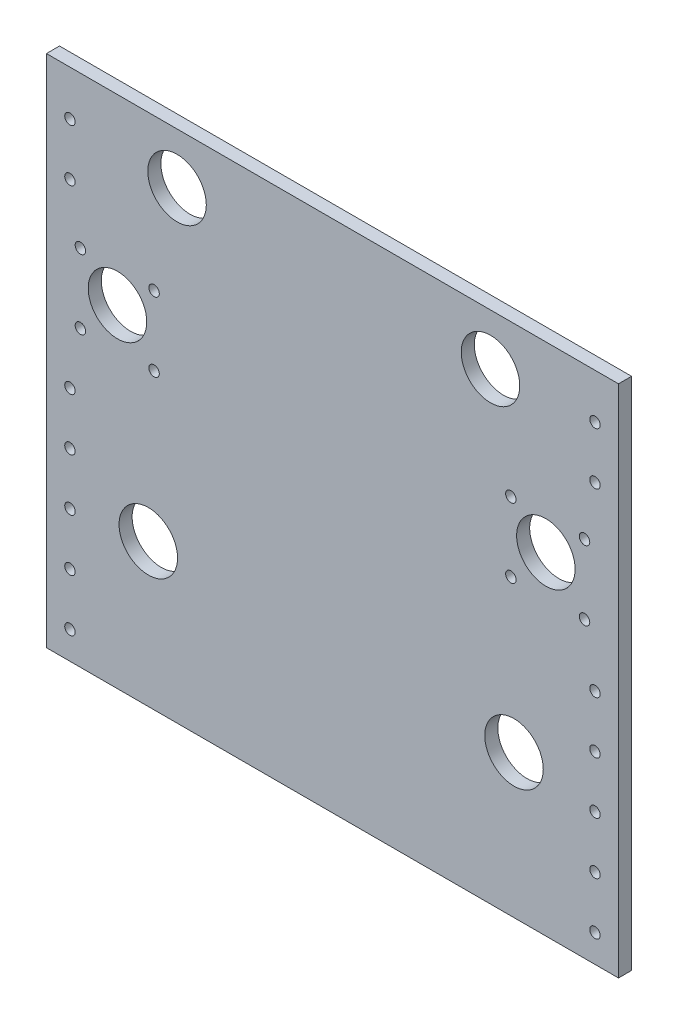
from build123d import *

# Parameters (mm, degrees)
SKETCH1_W               = 278.13
SKETCH1_H               = 250.19
BOSS_EXTRUDE1_DEPTH     = 6.35
CUT_EXTRUDE2_DEPTH      = 375.154587704
CUT_EXTRUDE2_DEPTH_BACK = 375.154587704
SKETCH3_R               = 14.224
CUT_EXTRUDE4_DEPTH      = 375.154587704
CUT_EXTRUDE4_DEPTH_BACK = 375.154587704
SKETCH5_R               = 2.54
CUT_EXTRUDE5_DEPTH      = 375.154587704
CUT_EXTRUDE5_DEPTH_BACK = 375.154587704
SKETCH7_R               = 2.54


with BuildPart() as part:
    # Sketch1 → Boss-Extrude1 (new body)
    with BuildSketch(Plane.XY):
        with Locations((139.065, 125.095)):
            Rectangle(SKETCH1_W, SKETCH1_H)
    extrude(amount=BOSS_EXTRUDE1_DEPTH)

    # Sketch3 → Cut-Extrude2 (cut, two sides: drawn at the far end of the back side and taken through both)
    with BuildSketch(Plane.XY.offset(6.35).offset(-CUT_EXTRUDE2_DEPTH_BACK)):
        with Locations((63.5, 225.298)):
            Circle(SKETCH3_R)
        with Locations((215.9, 225.298)):
            Circle(SKETCH3_R)
        with Locations((34.544, 161.544)):
            Circle(SKETCH3_R)
        with Locations((242.824, 161.544)):
            Circle(SKETCH3_R)
        with Locations((49.53, 69.596)):
            Circle(SKETCH3_R)
        with Locations((227.33, 69.596)):
            Circle(SKETCH3_R)
    extrude(amount=CUT_EXTRUDE2_DEPTH + CUT_EXTRUDE2_DEPTH_BACK, mode=Mode.SUBTRACT)

    # Sketch5 → Cut-Extrude4 (cut, two sides: drawn at the far end of the back side and taken through both)
    with BuildSketch(Plane.XY.offset(6.35).offset(-CUT_EXTRUDE4_DEPTH_BACK)):
        with Locations((11.43, 228.346)):
            Circle(SKETCH5_R)
        with Locations((11.43, 202.946)):
            Circle(SKETCH5_R)
        with Locations((266.7, 202.946)):
            Circle(SKETCH5_R)
        with Locations((266.7, 228.346)):
            Circle(SKETCH5_R)
        with Locations((11.43, 115.062)):
            Circle(SKETCH5_R)
        with Locations((11.43, 89.662)):
            Circle(SKETCH5_R)
        with Locations((11.43, 64.262)):
            Circle(SKETCH5_R)
        with Locations((11.43, 38.862)):
            Circle(SKETCH5_R)
        with Locations((11.43, 13.462)):
            Circle(SKETCH5_R)
        with Locations((266.7, 115.062)):
            Circle(SKETCH5_R)
        with Locations((266.7, 89.662)):
            Circle(SKETCH5_R)
        with Locations((266.7, 64.262)):
            Circle(SKETCH5_R)
        with Locations((266.7, 38.862)):
            Circle(SKETCH5_R)
        with Locations((266.7, 13.462)):
            Circle(SKETCH5_R)
    extrude(amount=CUT_EXTRUDE4_DEPTH + CUT_EXTRUDE4_DEPTH_BACK, mode=Mode.SUBTRACT)

    # Sketch7 → Cut-Extrude5 (cut, two sides: drawn at the far end of the back side and taken through both)
    with BuildSketch(Plane.XY.offset(6.35).offset(-CUT_EXTRUDE5_DEPTH_BACK)):
        with Locations((16.51, 176.53)):
            Circle(SKETCH7_R)
        with Locations((16.51, 142.748)):
            Circle(SKETCH7_R)
        with Locations((52.324, 142.748)):
            Circle(SKETCH7_R)
        with Locations((52.324, 176.53)):
            Circle(SKETCH7_R)
        with Locations((225.806, 176.53)):
            Circle(SKETCH7_R)
        with Locations((261.62, 176.53)):
            Circle(SKETCH7_R)
        with Locations((225.806, 142.748)):
            Circle(SKETCH7_R)
        with Locations((261.62, 142.748)):
            Circle(SKETCH7_R)
    extrude(amount=CUT_EXTRUDE5_DEPTH + CUT_EXTRUDE5_DEPTH_BACK, mode=Mode.SUBTRACT)


solid = part.part
